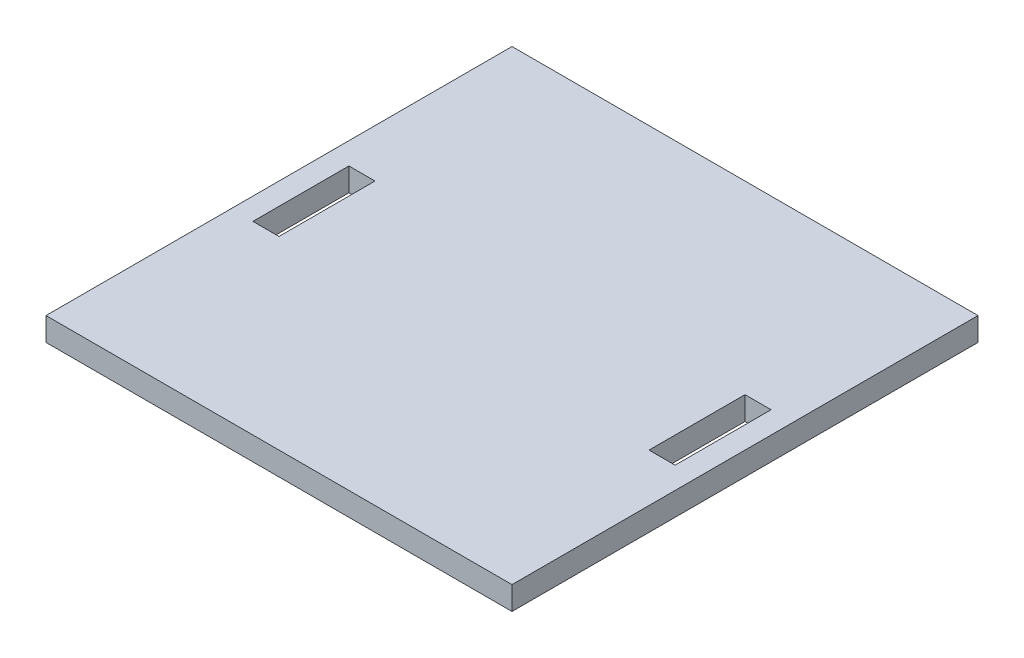
from build123d import *

# Parameters (mm, degrees)
SKETCH1_W           = 100
SKETCH1_H           = 100
SKETCH1_W_2         = 5.6
SKETCH1_H_2         = 20.6
BOSS_EXTRUDE1_DEPTH = 5


with BuildPart() as part:
    # Sketch1 → Boss-Extrude1 (new body)
    with BuildSketch(Plane(origin=(0, 0, 0), x_dir=(1, 0, 0), z_dir=(0, 1, 0))):
        with Locations((50, -50)):
            Rectangle(SKETCH1_W, SKETCH1_H)
        with Locations((7.5, -50)):
            Rectangle(SKETCH1_W_2, SKETCH1_H_2, mode=Mode.SUBTRACT)
        with Locations((92.5, -50)):
            Rectangle(SKETCH1_W_2, SKETCH1_H_2, mode=Mode.SUBTRACT)
    extrude(amount=BOSS_EXTRUDE1_DEPTH)


solid = part.part
